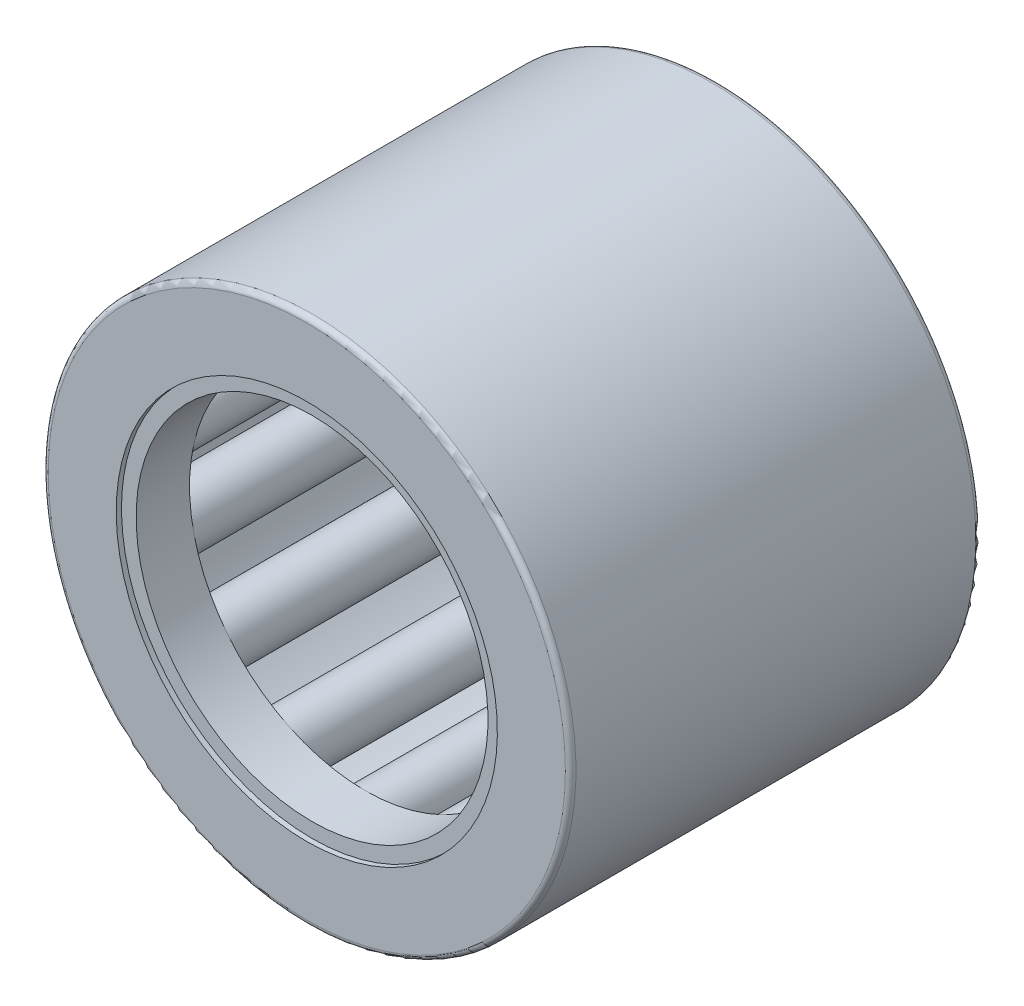
from build123d import *

# Parameters (mm, degrees)
SKETCH2_W         = 10
SKETCH2_H         = 0.75
SKETCH3_W         = 12
SKETCH3_H         = 0.25
CIRPATTERN1_COUNT = 14
CIRPATTERN1_ANGLE = 334.285714286
FILLET1_R         = 0.18
SKETCH4_W         = 1.82
SKETCH4_H         = 0.5
SKETCH5_W         = 1.82
SKETCH5_H         = 0.5


with BuildPart() as part:
    # Sketch7 → Revolve1 (revolve)
    with BuildSketch(Plane(origin=(0, 0, 0), x_dir=(0, 0, -1), z_dir=(1, 0, 0))):
        Polygon((-7, 9), (-7, 6.5), (-6, 6.5), (-6, 8), (6, 8), (6, 6.5), (7, 6.5), (7, 9), align=None)
    revolve(axis=Axis((0, 0, 7), (0, 0, -1)))

    # Fillet1
    fillet1_edges = [part.edges().sort_by_distance(p)[0] for p in [
        (0, -9, -7),
        (0, -9, 7),
    ]]
    fillet(fillet1_edges, radius=FILLET1_R)


with BuildPart() as body_2:
    # Sketch2 → Revolve2 (revolve)
    with BuildSketch(Plane(origin=(0, 0, 0), x_dir=(0, 0, -1), z_dir=(1, 0, 0))):
        with Locations((0, 7.625)):
            Rectangle(SKETCH2_W, SKETCH2_H)
    revolve(axis=Axis((0, 7, 5), (0, 0, -1)))


with BuildPart() as body_3:
    # Sketch3 → Revolve3 (revolve)
    with BuildSketch(Plane(origin=(0, 0, 0), x_dir=(0, 0, -1), z_dir=(1, 0, 0))):
        with Locations((0, 7.125)):
            Rectangle(SKETCH3_W, SKETCH3_H)
    revolve(axis=Axis((0, 7, 6), (0, 0, -1)))


with BuildPart() as cirpattern1_1:
    # CirPattern1: pattern copy
    add(body_2.part.rotate(Axis((0, 0, 7), (0, 0, -1)), 1 * CIRPATTERN1_ANGLE / (CIRPATTERN1_COUNT - 1)))


with BuildPart() as cirpattern1_2:
    # CirPattern1: pattern copy
    add(body_2.part.rotate(Axis((0, 0, 7), (0, 0, -1)), 2 * CIRPATTERN1_ANGLE / (CIRPATTERN1_COUNT - 1)))


with BuildPart() as cirpattern1_3:
    # CirPattern1: pattern copy
    add(body_2.part.rotate(Axis((0, 0, 7), (0, 0, -1)), 3 * CIRPATTERN1_ANGLE / (CIRPATTERN1_COUNT - 1)))


with BuildPart() as cirpattern1_4:
    # CirPattern1: pattern copy
    add(body_2.part.rotate(Axis((0, 0, 7), (0, 0, -1)), 4 * CIRPATTERN1_ANGLE / (CIRPATTERN1_COUNT - 1)))


with BuildPart() as cirpattern1_5:
    # CirPattern1: pattern copy
    add(body_2.part.rotate(Axis((0, 0, 7), (0, 0, -1)), 5 * CIRPATTERN1_ANGLE / (CIRPATTERN1_COUNT - 1)))


with BuildPart() as cirpattern1_6:
    # CirPattern1: pattern copy
    add(body_2.part.rotate(Axis((0, 0, 7), (0, 0, -1)), 6 * CIRPATTERN1_ANGLE / (CIRPATTERN1_COUNT - 1)))


with BuildPart() as cirpattern1_7:
    # CirPattern1: pattern copy
    add(body_2.part.rotate(Axis((0, 0, 7), (0, 0, -1)), 7 * CIRPATTERN1_ANGLE / (CIRPATTERN1_COUNT - 1)))


with BuildPart() as cirpattern1_8:
    # CirPattern1: pattern copy
    add(body_2.part.rotate(Axis((0, 0, 7), (0, 0, -1)), 8 * CIRPATTERN1_ANGLE / (CIRPATTERN1_COUNT - 1)))


with BuildPart() as cirpattern1_9:
    # CirPattern1: pattern copy
    add(body_2.part.rotate(Axis((0, 0, 7), (0, 0, -1)), 9 * CIRPATTERN1_ANGLE / (CIRPATTERN1_COUNT - 1)))


with BuildPart() as cirpattern1_10:
    # CirPattern1: pattern copy
    add(body_2.part.rotate(Axis((0, 0, 7), (0, 0, -1)), 10 * CIRPATTERN1_ANGLE / (CIRPATTERN1_COUNT - 1)))


with BuildPart() as cirpattern1_11:
    # CirPattern1: pattern copy
    add(body_2.part.rotate(Axis((0, 0, 7), (0, 0, -1)), 11 * CIRPATTERN1_ANGLE / (CIRPATTERN1_COUNT - 1)))


with BuildPart() as cirpattern1_12:
    # CirPattern1: pattern copy
    add(body_2.part.rotate(Axis((0, 0, 7), (0, 0, -1)), 12 * CIRPATTERN1_ANGLE / (CIRPATTERN1_COUNT - 1)))


with BuildPart() as cirpattern1_13:
    # CirPattern1: pattern copy
    add(body_2.part.rotate(Axis((0, 0, 7), (0, 0, -1)), 13 * CIRPATTERN1_ANGLE / (CIRPATTERN1_COUNT - 1)))


with BuildPart() as cirpattern1_14:
    # CirPattern1: pattern copy
    add(body_3.part.rotate(Axis((0, 0, 7), (0, 0, -1)), 1 * CIRPATTERN1_ANGLE / (CIRPATTERN1_COUNT - 1)))


with BuildPart() as cirpattern1_15:
    # CirPattern1: pattern copy
    add(body_3.part.rotate(Axis((0, 0, 7), (0, 0, -1)), 2 * CIRPATTERN1_ANGLE / (CIRPATTERN1_COUNT - 1)))


with BuildPart() as cirpattern1_16:
    # CirPattern1: pattern copy
    add(body_3.part.rotate(Axis((0, 0, 7), (0, 0, -1)), 3 * CIRPATTERN1_ANGLE / (CIRPATTERN1_COUNT - 1)))


with BuildPart() as cirpattern1_17:
    # CirPattern1: pattern copy
    add(body_3.part.rotate(Axis((0, 0, 7), (0, 0, -1)), 4 * CIRPATTERN1_ANGLE / (CIRPATTERN1_COUNT - 1)))


with BuildPart() as cirpattern1_18:
    # CirPattern1: pattern copy
    add(body_3.part.rotate(Axis((0, 0, 7), (0, 0, -1)), 5 * CIRPATTERN1_ANGLE / (CIRPATTERN1_COUNT - 1)))


with BuildPart() as cirpattern1_19:
    # CirPattern1: pattern copy
    add(body_3.part.rotate(Axis((0, 0, 7), (0, 0, -1)), 6 * CIRPATTERN1_ANGLE / (CIRPATTERN1_COUNT - 1)))


with BuildPart() as cirpattern1_20:
    # CirPattern1: pattern copy
    add(body_3.part.rotate(Axis((0, 0, 7), (0, 0, -1)), 7 * CIRPATTERN1_ANGLE / (CIRPATTERN1_COUNT - 1)))


with BuildPart() as cirpattern1_21:
    # CirPattern1: pattern copy
    add(body_3.part.rotate(Axis((0, 0, 7), (0, 0, -1)), 8 * CIRPATTERN1_ANGLE / (CIRPATTERN1_COUNT - 1)))


with BuildPart() as cirpattern1_22:
    # CirPattern1: pattern copy
    add(body_3.part.rotate(Axis((0, 0, 7), (0, 0, -1)), 9 * CIRPATTERN1_ANGLE / (CIRPATTERN1_COUNT - 1)))


with BuildPart() as cirpattern1_23:
    # CirPattern1: pattern copy
    add(body_3.part.rotate(Axis((0, 0, 7), (0, 0, -1)), 10 * CIRPATTERN1_ANGLE / (CIRPATTERN1_COUNT - 1)))


with BuildPart() as cirpattern1_24:
    # CirPattern1: pattern copy
    add(body_3.part.rotate(Axis((0, 0, 7), (0, 0, -1)), 11 * CIRPATTERN1_ANGLE / (CIRPATTERN1_COUNT - 1)))


with BuildPart() as cirpattern1_25:
    # CirPattern1: pattern copy
    add(body_3.part.rotate(Axis((0, 0, 7), (0, 0, -1)), 12 * CIRPATTERN1_ANGLE / (CIRPATTERN1_COUNT - 1)))


with BuildPart() as cirpattern1_26:
    # CirPattern1: pattern copy
    add(body_3.part.rotate(Axis((0, 0, 7), (0, 0, -1)), 13 * CIRPATTERN1_ANGLE / (CIRPATTERN1_COUNT - 1)))


with BuildPart() as body_30:
    # Sketch4 → Revolve4 (revolve)
    with BuildSketch(Plane(origin=(0, 0, 0), x_dir=(0, 0, -1), z_dir=(1, 0, 0))):
        with Locations((5.91, 6.25)):
            Rectangle(SKETCH4_W, SKETCH4_H)
    revolve(axis=Axis((0, 0, 7), (0, 0, -1)))


with BuildPart() as body_31:
    # Sketch5 → Revolve5 (revolve)
    with BuildSketch(Plane(origin=(0, 0, 0), x_dir=(0, 0, -1), z_dir=(1, 0, 0))):
        with Locations((-5.91, 6.25)):
            Rectangle(SKETCH5_W, SKETCH5_H)
    revolve(axis=Axis((0, 0, 7), (0, 0, -1)))


solid = Compound([part.part, body_2.part, body_3.part, cirpattern1_1.part, cirpattern1_2.part, cirpattern1_3.part, cirpattern1_4.part, cirpattern1_5.part, cirpattern1_6.part, cirpattern1_7.part, cirpattern1_8.part, cirpattern1_9.part, cirpattern1_10.part, cirpattern1_11.part, cirpattern1_12.part, cirpattern1_13.part, cirpattern1_14.part, cirpattern1_15.part, cirpattern1_16.part, cirpattern1_17.part, cirpattern1_18.part, cirpattern1_19.part, cirpattern1_20.part, cirpattern1_21.part, cirpattern1_22.part, cirpattern1_23.part, cirpattern1_24.part, cirpattern1_25.part, cirpattern1_26.part, body_30.part, body_31.part])
